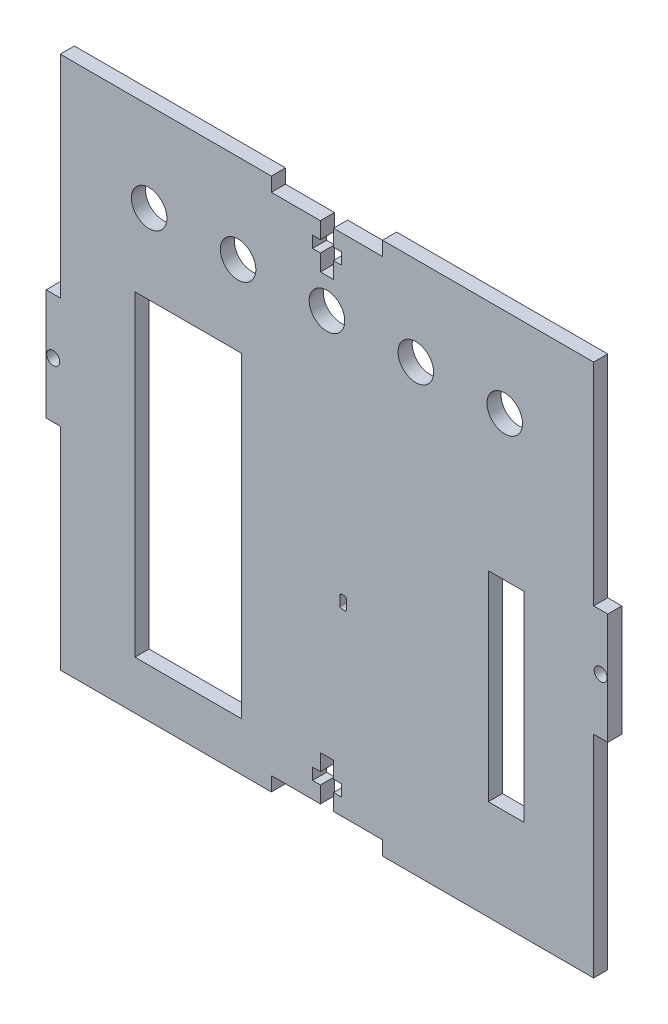
from build123d import *

# Parameters (mm, degrees)
SKETCH1_R           = 1.47
BOSS_EXTRUDE1_DEPTH = 1.5875
SKETCH3_W           = 8
SKETCH3_H           = 45
CUT_EXTRUDE1_DEPTH  = 88.184638842
SKETCH4_W           = 24
SKETCH4_H           = 71.2
CUT_EXTRUDE2_DEPTH  = 88.184638842
CUT_EXTRUDE4_DEPTH  = 88.184638842
SKETCH6_R           = 4
CUT_EXTRUDE5_DEPTH  = 88.184638842


with BuildPart() as part:
    # Sketch1 → Boss-Extrude1 (new, symmetric)
    with BuildSketch(Plane.XY):
        Polygon((-12.5, 60), (-60, 60), (-60, 12.5), (-63.175, 12.5), (-63.175, -12.5), (-60, -12.5), (-60, -60), (-12.5, -60), (-12.5, -56.825), (-1.47, -56.825), (-1.47, -53.125), (-3.25, -53.125), (-3.25, -50.525), (-1.47, -50.525), (-1.47, -46.825), (1.47, -46.825), (1.47, -50.525), (3.25, -50.525), (3.25, -53.125), (1.47, -53.125), (1.47, -56.825), (12.5, -56.825), (12.5, -60), (60, -60), (60, -12.5), (63.175, -12.5), (63.175, 12.5), (60, 12.5), (60, 60), (12.5, 60), (12.5, 56.825), (1.47, 56.825), (1.47, 53.125), (3.25, 53.125), (3.25, 50.525), (1.47, 50.525), (1.47, 46.825), (-1.47, 46.825), (-1.47, 50.525), (-3.25, 50.525), (-3.25, 53.125), (-1.47, 53.125), (-1.47, 56.825), (-12.5, 56.825), align=None)
        with Locations((-61.5875, 0)):
            Circle(SKETCH1_R, mode=Mode.SUBTRACT)
        with Locations(Location((61.5875, 0, 0), (0, 0, 180))):
            Circle(SKETCH1_R, mode=Mode.SUBTRACT)
    extrude(amount=BOSS_EXTRUDE1_DEPTH, both=True)

    # Sketch3 → Cut-Extrude1 (cut, through all)
    with BuildSketch(Plane(origin=(0, 0, -1.5875), x_dir=(-1, 0, 0), z_dir=(0, 0, -1))):
        with Locations((-40.3, -15)):
            Rectangle(SKETCH3_W, SKETCH3_H)
    extrude(amount=-CUT_EXTRUDE1_DEPTH, mode=Mode.SUBTRACT)

    # Sketch4 → Cut-Extrude2 (cut, through all)
    with BuildSketch(Plane(origin=(0, 0, -1.5875), x_dir=(-1, 0, 0), z_dir=(0, 0, -1))):
        with Locations((31.2, -13.494459363)):
            Rectangle(SKETCH4_W, SKETCH4_H)
    extrude(amount=-CUT_EXTRUDE2_DEPTH, mode=Mode.SUBTRACT)

    # Sketch5 → Cut-Extrude4 (cut, through all)
    with BuildSketch(Plane(origin=(0, 0, -1.5875), x_dir=(-1, 0, 0), z_dir=(0, 0, -1))):
        with BuildLine():
            Line((-3.324117887, -16.45), (-3.949848491, -16.45))
            ThreePointArc((-3.949848491, -16.45), (-4.214195834, -16.350200736), (-4.346634826, -16.10060241))
            ThreePointArc((-4.346634826, -16.10060241), (-4.416532026, -15), (-4.346634826, -13.89939759))
            ThreePointArc((-4.346634826, -13.89939759), (-4.214195834, -13.649799264), (-3.949848491, -13.55))
            Line((-3.949848491, -13.55), (-3.324117887, -13.55))
            ThreePointArc((-3.324117887, -13.55), (-3.041275174, -13.667157288), (-2.924117887, -13.95))
            Line((-2.924117887, -13.95), (-2.924117887, -16.05))
            ThreePointArc((-2.924117887, -16.05), (-3.041275174, -16.332842712), (-3.324117887, -16.45))
        make_face()
    extrude(amount=-CUT_EXTRUDE4_DEPTH, mode=Mode.SUBTRACT)

    # Sketch6 → Cut-Extrude5 (cut, through all)
    with BuildSketch(Plane(origin=(0, 0, -1.5875), x_dir=(-1, 0, 0), z_dir=(0, 0, -1))):
        with Locations((40, 40)):
            Circle(SKETCH6_R)
        with Locations((20, 40)):
            Circle(SKETCH6_R)
        with Locations((0, 40)):
            Circle(SKETCH6_R)
        with Locations((-20, 40)):
            Circle(SKETCH6_R)
        with Locations((-40, 40)):
            Circle(SKETCH6_R)
    extrude(amount=-CUT_EXTRUDE5_DEPTH, mode=Mode.SUBTRACT)


solid = part.part
